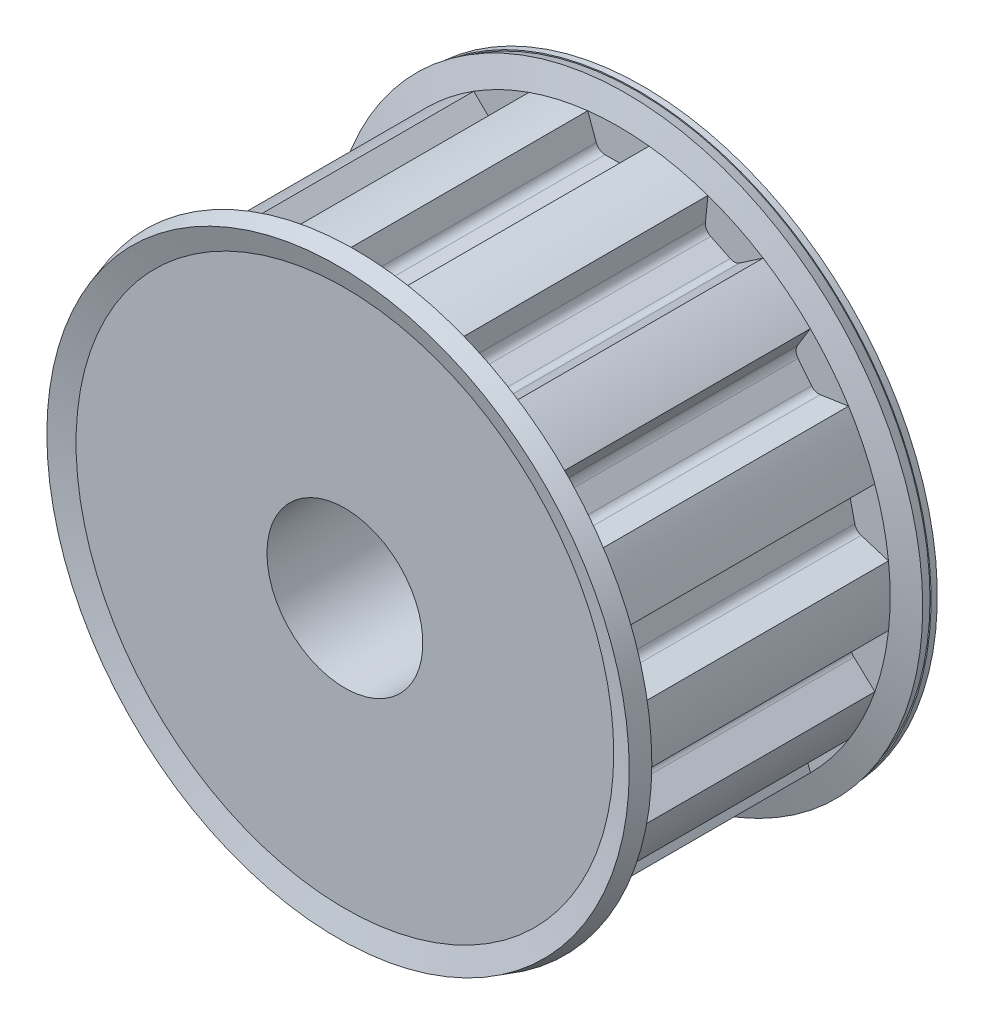
from build123d import *

# Parameters (mm, degrees)
SKETCH1_R           = 11.0617
BASEPULLEY_DEPTH    = 10.414
GROOVE_DEPTH        = 5.207
GROOVES_COUNT       = 14
GROOVES_ANGLE       = 334.285714286
SKETCH4_W           = 0.254
SKETCH4_H           = 11.43
BORSKE_R            = 3.175
BORE_DEPTH          = 21.970083094
BOSS_EXTRUDE1_START = 0.254
SKETCH7_R           = 11.992065176
SKETCH7_R_2         = 3.175
BOSS_EXTRUDE1_DEPTH = 0.254


with BuildPart() as part:
    # Sketch1 → BasePulley (new body)
    with BuildSketch(Plane.XY):
        Circle(SKETCH1_R)
    extrude(amount=-BASEPULLEY_DEPTH)

    # Sketch2 → Flange (revolve)
    with BuildSketch(Plane(origin=(0, 0, 0), x_dir=(0, 0, -1), z_dir=(1, 0, 0)), mode=Mode.PRIVATE) as flange_sk:
        Polygon((10.414, 11.0617), (10.724622372, 12.0777), (11.429036456, 11.862339002), (11.1506, 10.951614392), (11.1506, 0), (-0.7366, 0), (-0.7366, 10.951614392), (-1.015036456, 11.862339002), (-0.310622372, 12.0777), (0, 11.0617), align=None)
    revolve(flange_sk.sketch.rotate(Axis((0, 0, 0), (0, 0, -1)), 90), axis=Axis((0, 0, 0), (0, 0, -1)))

    # Sketch3 → Groove (cut, symmetric)
    with BuildSketch(Plane.XY.offset(-5.207)):
        with BuildLine():
            Line((-1.2827, 11.0617), (-1.2827, 36.4617))
            Line((-1.2827, 36.4617), (1.2827, 36.4617))
            Line((1.2827, 36.4617), (1.2827, 11.0617))
            Line((1.2827, 11.0617), (0.659450384, 9.9822))
            ThreePointArc((0.659450384, 9.9822), (0.519994706, 9.842744321), (0.329494706, 9.7917))
            Line((0.329494706, 9.7917), (-0.55367873, 9.7917))
            ThreePointArc((-0.55367873, 9.7917), (-0.772211353, 9.860603071), (-0.911701619, 10.042390325))
            Line((-0.911701619, 10.042390325), (-1.2827, 11.0617))
        make_face()
    groove = extrude(amount=GROOVE_DEPTH, both=True, mode=Mode.SUBTRACT)

    # Grooves: Groove ×14 about axis
    grooves_axis = Axis((0, 0, -10.414), (0, 0, 1))
    for i in range(1, GROOVES_COUNT):
        add(groove.rotate(grooves_axis, i * GROOVES_ANGLE / (GROOVES_COUNT - 1)), mode=Mode.SUBTRACT)

    # Sketch4 → BaseHub (revolve)
    with BuildSketch(Plane(origin=(0, 0, 0), x_dir=(0, 0, -1), z_dir=(1, 0, 0)), mode=Mode.PRIVATE) as basehub_sk:
        with Locations((-0.127, 5.715)):
            Rectangle(SKETCH4_W, SKETCH4_H)
    revolve(basehub_sk.sketch.rotate(Axis((0, 0, 0), (0, 0, -1)), 90), axis=Axis((0, 0, 0), (0, 0, -1)))

    # BorSke → Bore (cut, through all)
    with BuildSketch(Plane(origin=(0, 0, -11.1506), x_dir=(-1, 0, 0), z_dir=(0, 0, -1))):
        Circle(BORSKE_R)
    extrude(amount=-BORE_DEPTH, mode=Mode.SUBTRACT)

    # Sketch7 → Boss-Extrude1 (add)
    with BuildSketch(Plane(origin=(0, 0, -11.1506), x_dir=(-1, 0, 0), z_dir=(0, 0, -1)).offset(BOSS_EXTRUDE1_START)):
        Circle(SKETCH7_R)
        Circle(SKETCH7_R_2, mode=Mode.SUBTRACT)
    extrude(amount=-BOSS_EXTRUDE1_DEPTH)


solid = part.part
